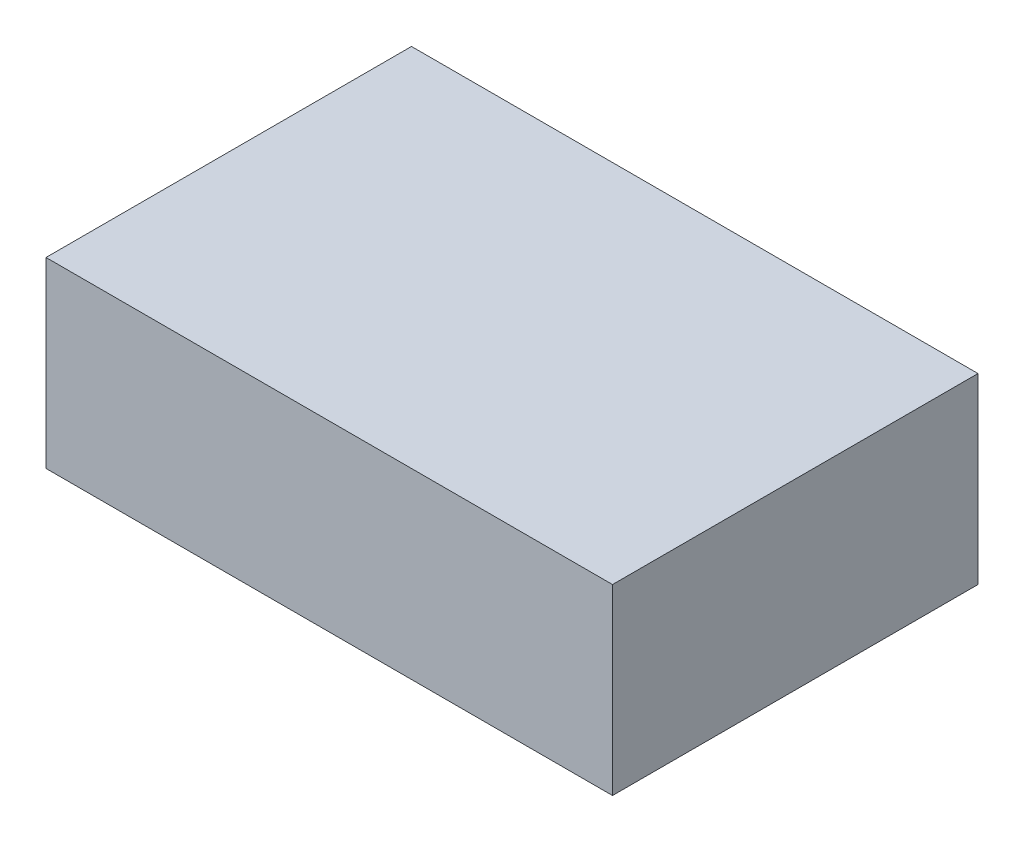
from build123d import *

# Parameters (mm, degrees)
SKETCH1_W           = 31
SKETCH1_H           = 20
BOSS_EXTRUDE1_DEPTH = 10


with BuildPart() as part:
    # Sketch1 → Boss-Extrude1 (new body)
    with BuildSketch(Plane(origin=(0, 0, 0), x_dir=(1, 0, 0), z_dir=(0, 1, 0))):
        with Locations((15.5, 10)):
            Rectangle(SKETCH1_W, SKETCH1_H)
    extrude(amount=BOSS_EXTRUDE1_DEPTH)


solid = part.part
